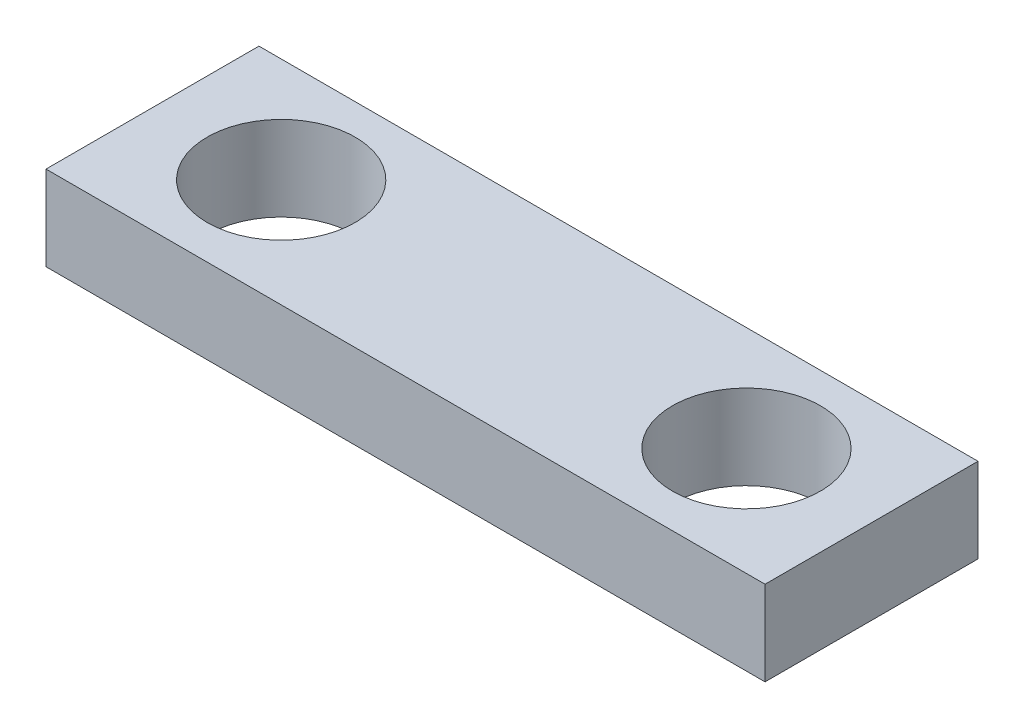
from build123d import *

# Parameters (mm, degrees)
SKETCH_1_W      = 17
SKETCH_1_H      = 5.034755363
SKETCH_1_R      = 1.75
EXTRUDE_1_DEPTH = 2


with BuildPart() as part:
    # 草图1 → 凸台-拉伸1 (new body)
    with BuildSketch(Plane(origin=(0, 0, 0), x_dir=(1, 0, 0), z_dir=(0, 1, 0))):
        with Locations((-0.118818502, 0.341339346)):
            Rectangle(SKETCH_1_W, SKETCH_1_H)
        with Locations(Location((-5.618818502, 0.384006765, 0), (0, 0, 270))):
            Circle(SKETCH_1_R, mode=Mode.SUBTRACT)
        with Locations(Location((5.381181498, 0.384006765, 0), (0, 0, 270))):
            Circle(SKETCH_1_R, mode=Mode.SUBTRACT)
    extrude(amount=EXTRUDE_1_DEPTH)


solid = part.part
